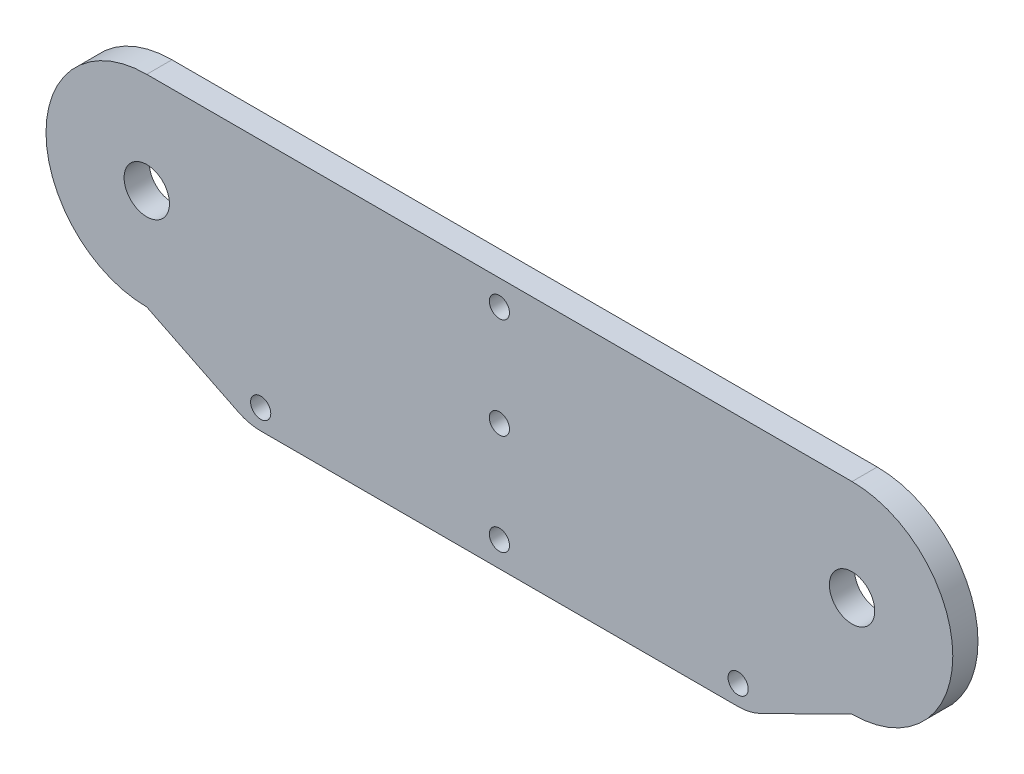
from build123d import *

# Parameters (mm, degrees)
EXTRUDE_1_DEPTH     = 5
SKETCH_2_R          = 2
CUT_EXTRUDE_1_DEPTH = 5


with BuildPart() as part:
    # 草图1 → 凸台-拉伸1 (new body)
    with BuildSketch(Plane.XY):
        with BuildLine():
            ThreePointArc((20, 0), (14.142135624, 14.142135624), (0, 20))
            Line((0, 20), (0, 4.5))
            ThreePointArc((0, 4.5), (3.181980515, 3.181980515), (4.5, 0))
            ThreePointArc((4.5, 0), (3.181980515, -3.181980515), (0, -4.5))
            Line((0, -4.5), (0, -20))
            ThreePointArc((0, -20), (14.142135624, -14.142135624), (20, 0))
        make_face()
        with BuildLine():
            Line((0, 4.5), (0, 20))
            ThreePointArc((0, 20), (-20, 0), (0, -20))
            Line((0, -20), (0, -4.5))
            ThreePointArc((0, -4.5), (-4.5, 0), (0, 4.5))
        make_face()
        with BuildLine():
            Line((70, 20), (0, 20))
            ThreePointArc((0, 20), (14.142135624, 14.142135624), (20, 0))
            ThreePointArc((20, 0), (14.142135624, -14.142135624), (0, -20))
            Line((0, -20), (18.19327595, -28.969251351))
            ThreePointArc((18.19327595, -28.969251351), (20.344914528, -29.738904289), (22.615100256, -30))
            Line((22.615100256, -30), (70, -30))
            Line((70, -30), (70, -27))
            ThreePointArc((70, -27), (68, -25), (70, -23))
            Line((70, -23), (70, -7))
            ThreePointArc((70, -7), (68, -5), (70, -3))
            Line((70, -3), (70, 13))
            ThreePointArc((70, 13), (68, 15), (70, 17))
            Line((70, 17), (70, 20))
        make_face()
        with BuildLine():
            Line((140, 20), (70, 20))
            Line((70, 20), (70, 17))
            ThreePointArc((70, 17), (71.414213562, 16.414213562), (72, 15))
            ThreePointArc((72, 15), (71.414213562, 13.585786438), (70, 13))
            Line((70, 13), (70, -3))
            ThreePointArc((70, -3), (71.414213562, -3.585786438), (72, -5))
            ThreePointArc((72, -5), (71.414213562, -6.414213562), (70, -7))
            Line((70, -7), (70, -23))
            ThreePointArc((70, -23), (71.414213562, -23.585786438), (72, -25))
            ThreePointArc((72, -25), (71.414213562, -26.414213562), (70, -27))
            Line((70, -27), (70, -30))
            Line((70, -30), (117.384899744, -30))
            ThreePointArc((117.384899744, -30), (119.655085472, -29.738904289), (121.80672405, -28.969251351))
            Line((121.80672405, -28.969251351), (140, -20))
            ThreePointArc((140, -20), (120, 0), (140, 20))
        make_face()
        with BuildLine():
            ThreePointArc((160, 0), (154.142135624, 14.142135624), (140, 20))
            Line((140, 20), (140, 4.5))
            ThreePointArc((140, 4.5), (143.181980515, 3.181980515), (144.5, 0))
            ThreePointArc((144.5, 0), (143.181980515, -3.181980515), (140, -4.5))
            Line((140, -4.5), (140, -20))
            ThreePointArc((140, -20), (154.142135624, -14.142135624), (160, 0))
        make_face()
        with BuildLine():
            Line((140, 4.5), (140, 20))
            ThreePointArc((140, 20), (120, 0), (140, -20))
            Line((140, -20), (140, -4.5))
            ThreePointArc((140, -4.5), (135.5, 0), (140, 4.5))
        make_face()
    extrude(amount=EXTRUDE_1_DEPTH)

    # 草图2 → 切除-拉伸1 (cut)
    with BuildSketch(Plane.XY.offset(5)):
        with Locations((22.615100256, -26)):
            Circle(SKETCH_2_R)
        with Locations((117.384899744, -26)):
            Circle(SKETCH_2_R)
    extrude(amount=-CUT_EXTRUDE_1_DEPTH, mode=Mode.SUBTRACT)


solid = part.part
